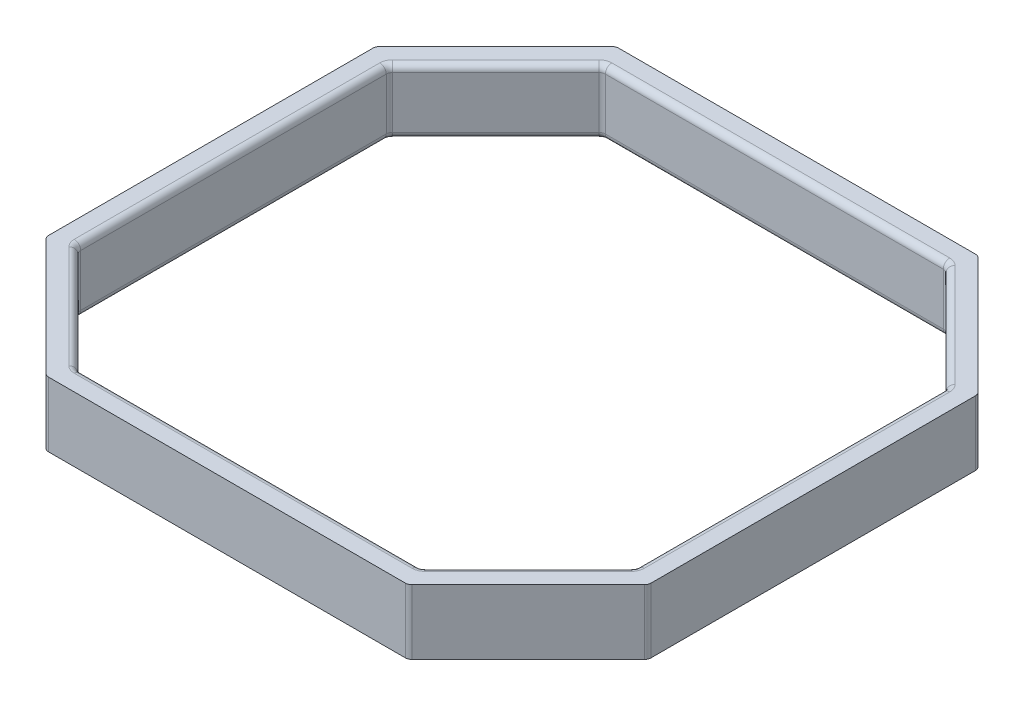
from build123d import *

# Parameters (mm, degrees)
BOSS_EXTRUDE1_DEPTH = 10
FILLET1_R           = 1


with BuildPart() as part:
    # Sketch1 → Boss-Extrude1 (new body)
    with BuildSketch(Plane(origin=(0, 0, 0), x_dir=(1, 0, 0), z_dir=(0, 1, 0))):
        Polygon((-46.5, 25.449747468), (-27.949747468, 44), (27.949747468, 44), (46.5, 25.449747468), (46.5, -25.449747468), (27.949747468, -44), (-27.949747468, -44), (-46.5, -25.449747468), align=None)
        Polygon((-43, 24), (-26.5, 40.5), (26.5, 40.5), (43, 24), (43, -24), (26.5, -40.5), (-26.5, -40.5), (-43, -24), align=None, mode=Mode.SUBTRACT)
    extrude(amount=BOSS_EXTRUDE1_DEPTH)

    # Fillet1
    fillet1_edges = [part.edges().sort_by_distance(p)[0] for p in [
        (-46.5, 5, -25.449747468),
        (-27.949747468, 5, -44),
        (27.949747468, 5, -44),
        (46.5, 5, -25.449747468),
        (46.5, 5, 25.449747468),
        (27.949747468, 5, 44),
        (-27.949747468, 5, 44),
        (-46.5, 5, 25.449747468),
        (-43, 0, 0),
        (-43, 5, -24),
        (-34.75, 0, 32.25),
        (-43, 5, 24),
        (0, 0, 40.5),
        (-26.5, 5, 40.5),
        (34.75, 0, 32.25),
        (26.5, 5, 40.5),
        (43, 0, 0),
        (43, 5, 24),
        (34.75, 0, -32.25),
        (43, 5, -24),
        (0, 0, -40.5),
        (26.5, 5, -40.5),
        (-34.75, 0, -32.25),
        (-26.5, 5, -40.5),
        (-43, 10, 0),
        (-34.75, 10, 32.25),
        (0, 10, 40.5),
        (34.75, 10, 32.25),
        (43, 10, 0),
        (34.75, 10, -32.25),
        (0, 10, -40.5),
        (-34.75, 10, -32.25),
    ]]
    fillet(fillet1_edges, radius=FILLET1_R)


solid = part.part
